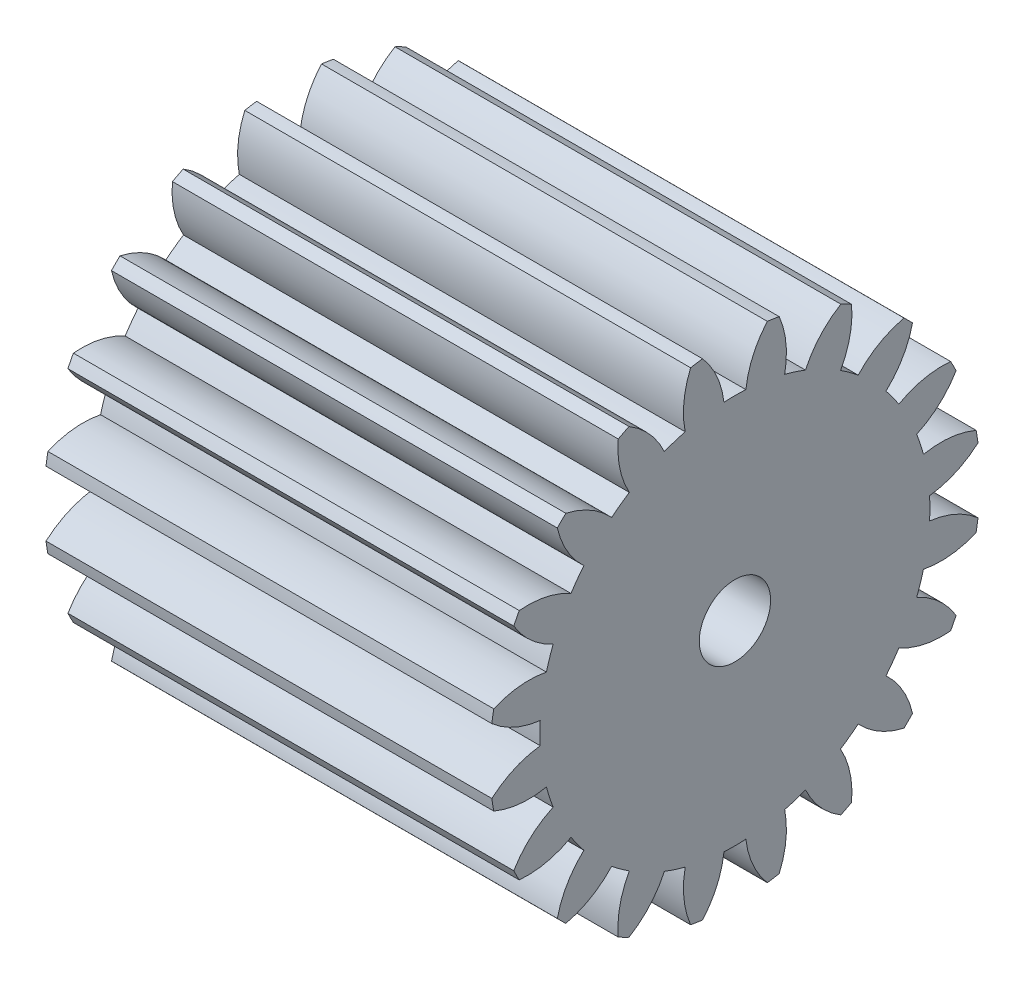
from build123d import *

# Parameters (mm, degrees)
BASPROSKE_W     = 5
BASPROSKE_H     = 2.75
TOOTHCUT_DEPTH  = 7.33442973
TEETHCUTS_COUNT = 20
TEETHCUTS_ANGLE = 342
BORSKE_R        = 0.4
BORE_DEPTH      = 50.0000508


with BuildPart() as part:
    # BasProSke → Base-Revolve (revolve)
    with BuildSketch(Plane(origin=(0, 0, 0), x_dir=(1, 0, 0), z_dir=(0, 1, 0))):
        with Locations((2.5, 1.375)):
            Rectangle(BASPROSKE_W, BASPROSKE_H)
    revolve(axis=Axis((-10, 0, 0), (1, 0, 0)))

    # TooCutSke → ToothCut (cut, through all)
    with BuildSketch(Plane(origin=(0, 0, 0), x_dir=(0, 0, -1), z_dir=(1, 0, 0))):
        with BuildLine():
            ThreePointArc((0.12259479, 2.183060413), (0, 2.1865), (-0.12259479, 2.183060413))
            ThreePointArc((-0.12259479, 2.183060413), (-0.208100745, 2.48676384), (-0.383972608, 2.748710642))
            ThreePointArc((-0.383972608, 2.748710642), (0, 2.7754), (0.383972608, 2.748710642))
            ThreePointArc((0.383972608, 2.748710642), (0.208100745, 2.48676384), (0.12259479, 2.183060413))
        make_face()
    toothcut = extrude(amount=TOOTHCUT_DEPTH, mode=Mode.SUBTRACT)

    # TeethCuts: ToothCut ×20 about axis
    teethcuts_axis = Axis((-10, 0, 0), (1, 0, 0))
    for i in range(1, TEETHCUTS_COUNT):
        add(toothcut.rotate(teethcuts_axis, i * TEETHCUTS_ANGLE / (TEETHCUTS_COUNT - 1)), mode=Mode.SUBTRACT)

    # BorSke → Bore (cut, symmetric)
    with BuildSketch(Plane(origin=(0, 0, 0), x_dir=(0, 0, -1), z_dir=(1, 0, 0))):
        Circle(BORSKE_R)
    extrude(amount=BORE_DEPTH, both=True, mode=Mode.SUBTRACT)


solid = part.part
